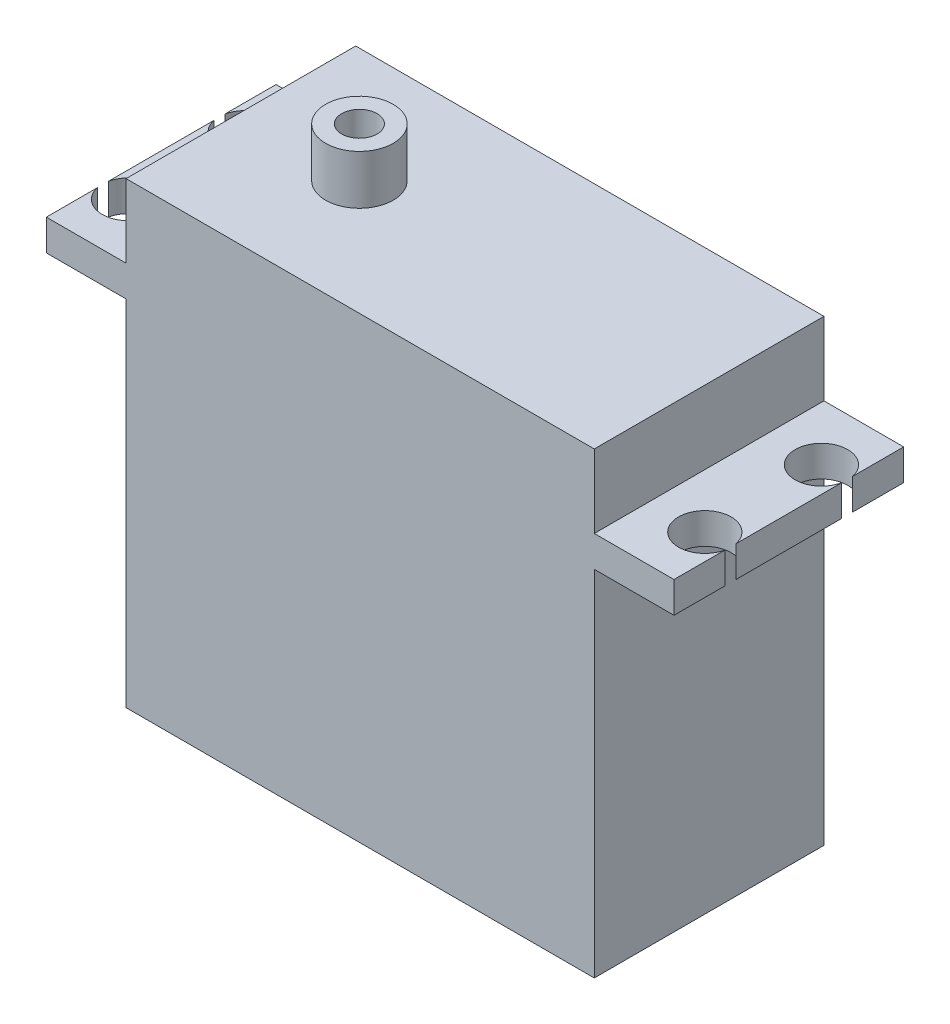
from build123d import *

# Parameters (mm, degrees)
SKETCH1_W           = 40.2844
SKETCH1_H           = 19.7612
BOSS_EXTRUDE1_DEPTH = 39.4208
SKETCH2_W           = 19.7612
SKETCH2_H           = 2.667
BOSS_EXTRUDE2_DEPTH = 6.858
SKETCH3_R           = 2.2606
CUT_EXTRUDE2_DEPTH  = 44.859747411
SKETCH4_R           = 2.9083
BOSS_EXTRUDE3_DEPTH = 4.2418
SKETCH5_R           = 1.524
CUT_EXTRUDE3_DEPTH  = 7.4422


with BuildPart() as part:
    # Sketch1 → Boss-Extrude1 (new body)
    with BuildSketch(Plane(origin=(0, 0, 0), x_dir=(1, 0, 0), z_dir=(0, 1, 0))):
        Rectangle(SKETCH1_W, SKETCH1_H)
    extrude(amount=BOSS_EXTRUDE1_DEPTH)

    # Sketch2 → Boss-Extrude2 (add)
    with BuildSketch(Plane(origin=(20.1422, 0, 0), x_dir=(0, 0, -1), z_dir=(1, 0, 0))):
        with Locations((0, 31.7881)):
            Rectangle(SKETCH2_W, SKETCH2_H)
    boss_extrude2 = extrude(amount=BOSS_EXTRUDE2_DEPTH)

    # Sketch3 → Cut-Extrude2 (cut, through all)
    with BuildSketch(Plane(origin=(0, 33.1216, 0), x_dir=(1, 0, 0), z_dir=(0, 1, 0))):
        with Locations((24.7904, 5.0165)):
            Circle(SKETCH3_R)
        with Locations((24.7904, -5.0165)):
            Circle(SKETCH3_R)
    cut_extrude2 = extrude(amount=-CUT_EXTRUDE2_DEPTH, mode=Mode.SUBTRACT)

    # Mirror1: Boss-Extrude2, Cut-Extrude2 across plane
    add(boss_extrude2.mirror(Plane(origin=(0, 0, 0), x_dir=(0, 0, 1), z_dir=(1, 0, 0))))
    add(cut_extrude2.mirror(Plane(origin=(0, 0, 0), x_dir=(0, 0, 1), z_dir=(1, 0, 0))), mode=Mode.SUBTRACT)

    # Sketch4 → Boss-Extrude3 (add)
    with BuildSketch(Plane(origin=(0, 39.4208, 0), x_dir=(1, 0, 0), z_dir=(0, 1, 0))):
        with Locations(Location((-9.9441, 0, 0), (0, 0, 90))):
            Circle(SKETCH4_R)
    extrude(amount=BOSS_EXTRUDE3_DEPTH)

    # Sketch5 → Cut-Extrude3 (cut)
    with BuildSketch(Plane(origin=(0, 43.6626, 0), x_dir=(1, 0, 0), z_dir=(0, 1, 0))):
        with Locations(Location((-9.9441, 0, 0), (0, 0, 270))):
            Circle(SKETCH5_R)
    extrude(amount=-CUT_EXTRUDE3_DEPTH, mode=Mode.SUBTRACT)


solid = part.part
